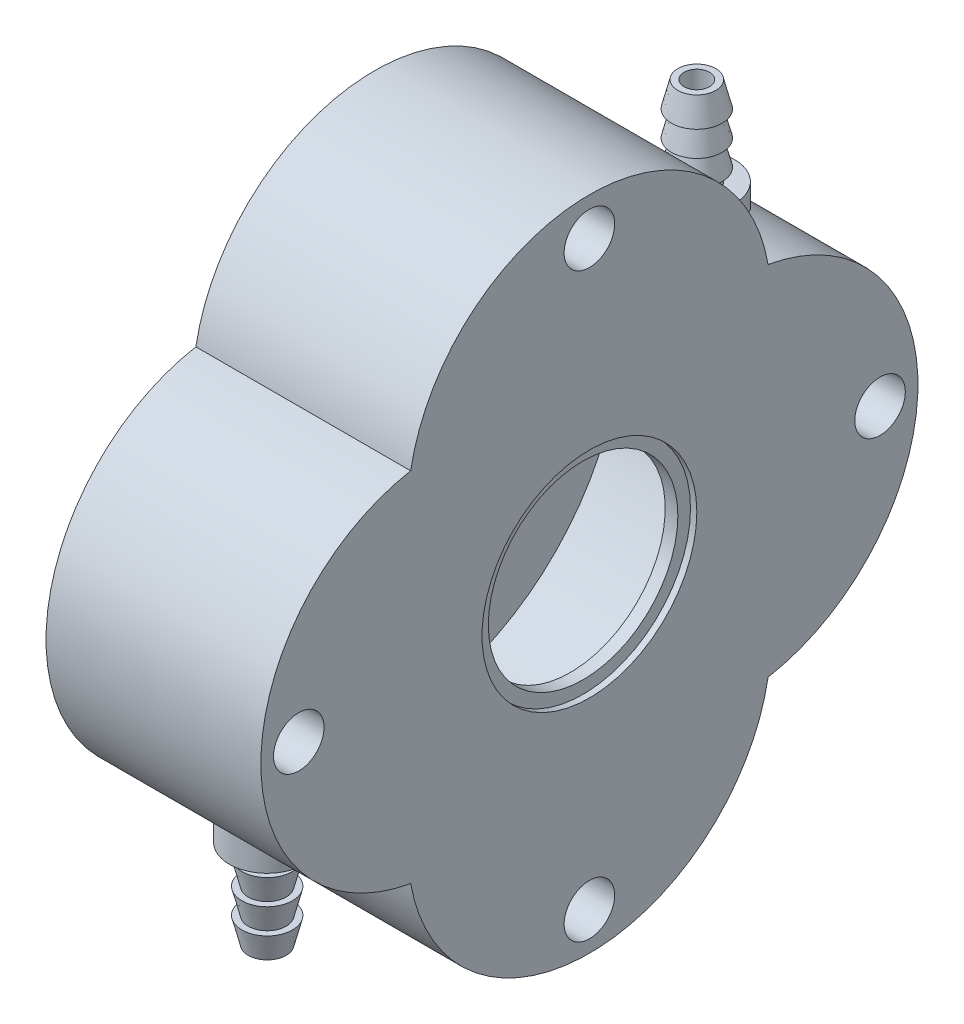
from build123d import *

# Parameters (mm, degrees)
SKETCH2_R           = 2
SKETCH2_R_2         = 7.5
FLANGE_DEPTH        = 8.5
SKETCH3_R           = 8.5
O_RING_SEAT_DEPTH   = 0.5
SKETCH8_R           = 18
CUT_EXTRUDE1_DEPTH  = 7
SKETCH5_R           = 1
OUTLET_DEPTH        = 38.739236876
BOSS_EXTRUDE2_REACH = 50.576
SKETCH6_R           = 3
SKETCH6_R_2         = 1
INLET_COUNT         = 2


with BuildPart() as part:
    # Sketch2 → Flange (new, symmetric)
    with BuildSketch(Plane(origin=(0, 0, 0), x_dir=(0, 0, -1), z_dir=(1, 0, 0))):
        with BuildLine():
            ThreePointArc((-14.142135624, 14.142135624), (-26, 0), (-14.142135624, -14.142135624))
            ThreePointArc((-14.142135624, -14.142135624), (0, -26), (14.142135624, -14.142135624))
            ThreePointArc((14.142135624, -14.142135624), (26, 0), (14.142135624, 14.142135624))
            ThreePointArc((14.142135624, 14.142135624), (0, 26), (-14.142135624, 14.142135624))
        make_face()
        with Locations((0, 23)):
            Circle(SKETCH2_R, mode=Mode.SUBTRACT)
        with Locations((23, 0)):
            Circle(SKETCH2_R, mode=Mode.SUBTRACT)
        with Locations((0, -23)):
            Circle(SKETCH2_R, mode=Mode.SUBTRACT)
        with Locations((-23, 0)):
            Circle(SKETCH2_R, mode=Mode.SUBTRACT)
        Circle(SKETCH2_R_2, mode=Mode.SUBTRACT)
    extrude(amount=FLANGE_DEPTH, both=True)

    # Sketch3 → O-Ring Seat (cut)
    with BuildSketch(Plane(origin=(8.5, 0, 0), x_dir=(0, 0, -1), z_dir=(1, 0, 0))):
        Circle(SKETCH3_R)
    o_ring_seat = extrude(amount=-O_RING_SEAT_DEPTH, mode=Mode.SUBTRACT)

    # Mirror1: O-Ring Seat across plane
    add(o_ring_seat.mirror(Plane(origin=(0, 0, 0), x_dir=(0, 0, 1), z_dir=(1, 0, 0))), mode=Mode.SUBTRACT)

    # Sketch8 → Cut-Extrude1 (cut, symmetric)
    with BuildSketch(Plane.ZY):
        Circle(SKETCH8_R)
    extrude(amount=CUT_EXTRUDE1_DEPTH, both=True, mode=Mode.SUBTRACT)

    # Sketch5 → Outlet (cut, through all)
    with BuildSketch(Plane(origin=(0, 0, 0), x_dir=(1, 0, 0), z_dir=(0, 1, 0))):
        with Locations(Location((0, 17, 0), (0, 0, 90))):
            Circle(SKETCH5_R)
    outlet = extrude(amount=OUTLET_DEPTH, mode=Mode.SUBTRACT)

    # Sketch6 → Boss-Extrude2 (add, up to next)
    with BuildSketch(Plane(origin=(0, 14.142135624, 0), x_dir=(1, 0, 0), z_dir=(0, 1, 0)), mode=Mode.PRIVATE) as boss_extrude2_sk1:
        with Locations((0, 17)):
            Circle(SKETCH6_R)
        with Locations(Location((0, 17, 0), (0, 0, 90))):
            Circle(SKETCH6_R_2, mode=Mode.SUBTRACT)
    boss_extrude2_tool1 = extrude(boss_extrude2_sk1.sketch, amount=-BOSS_EXTRUDE2_REACH, mode=Mode.PRIVATE) - part.part
    boss_extrude2 = boss_extrude2_tool1.solids().sort_by_distance((-2.915147, 14.142136, -17))[0]
    add(boss_extrude2)

    # Sketch9 → Revolve1 (revolve)
    with BuildSketch(Plane(origin=(0, 0, 0), x_dir=(0, 0, -1), z_dir=(1, 0, 0)), mode=Mode.PRIVATE) as revolve1_sk:
        Polygon((18, 14.142135624), (18, 21.142135624), (18.5, 21.142135624), (19, 19.142135624), (18.5, 19.142135624), (19, 17.142135624), (18.5, 17.142135624), (19, 15.142135624), (18.5, 15.142135624), (18.5, 14.142135624), align=None)
    revolve1 = revolve(revolve1_sk.sketch.rotate(Axis((0, 14.142135624, -17), (0, -1, 0)), 180), axis=Axis((0, 14.142135624, -17), (0, -1, 0)))

    # Inlet: Outlet, Boss-Extrude2, Revolve1 ×2 about axis
    inlet_axis = Axis((8, 0, 0), (1, 0, 0))
    add([outlet.rotate(inlet_axis, i * 360 / INLET_COUNT) for i in range(1, INLET_COUNT)], mode=Mode.SUBTRACT)
    add([boss_extrude2.rotate(inlet_axis, i * 360 / INLET_COUNT) for i in range(1, INLET_COUNT)])
    add([revolve1.rotate(inlet_axis, i * 360 / INLET_COUNT) for i in range(1, INLET_COUNT)])


solid = part.part
